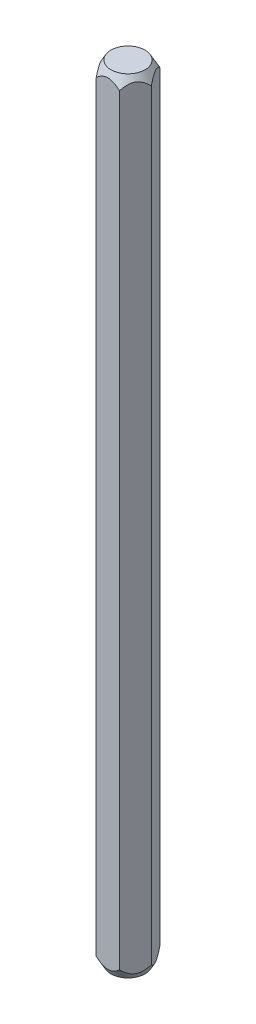
from build123d import *

# Parameters (mm, degrees)
BOSS_EXTRUDE1_DEPTH = 25.25


with BuildPart() as part:
    # Sketch1 → Boss-Extrude1 (new, symmetric)
    with BuildSketch(Plane(origin=(0, 0, 0), x_dir=(1, 0, 0), z_dir=(0, 1, 0))):
        Polygon((1.5, 0), (0.75, 1.299038106), (-0.75, 1.299038106), (-1.5, 0), (-0.75, -1.299038106), (0.75, -1.299038106), align=None)
    extrude(amount=BOSS_EXTRUDE1_DEPTH, both=True)

    # Sketch2 → Cut-Revolve1 (revolve, cut)
    with BuildSketch(Plane.XY, mode=Mode.PRIVATE) as cut_revolve1_sk:
        Polygon((1.5, 25.25), (1.5, 24.55), (1.1, 25.25), align=None)
        Polygon((1.5, -25.25), (1.5, -24.55), (1.1, -25.25), align=None)
    revolve(cut_revolve1_sk.sketch.rotate(Axis((0, -25.25, 0), (0, 1, 0)), 300.000003979), axis=Axis((0, -25.25, 0), (0, 1, 0)), mode=Mode.SUBTRACT)


solid = part.part
